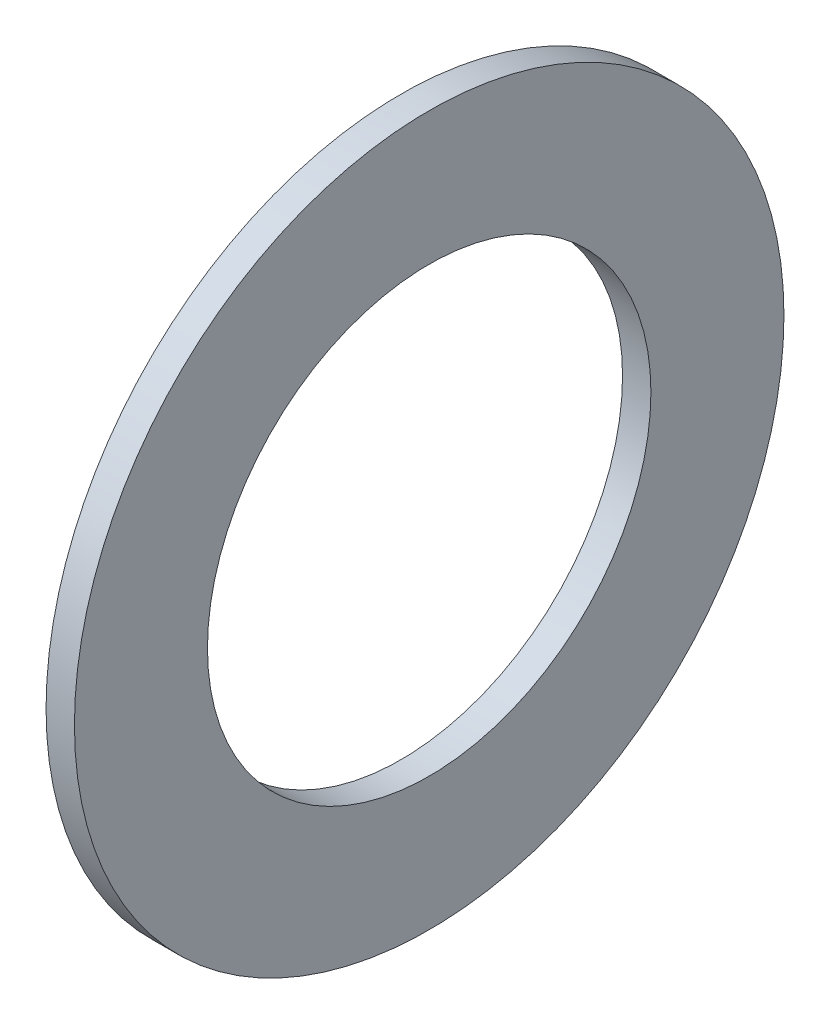
from build123d import *

# Parameters (mm, degrees)
SKETCH1_R           = 6.35
SKETCH1_R_2         = 3.96875
BOSS_EXTRUDE1_DEPTH = 0.508


with BuildPart() as part:
    # Sketch1 → Boss-Extrude1 (new body)
    with BuildSketch(Plane(origin=(0, 0, 0), x_dir=(0, 0, -1), z_dir=(1, 0, 0))):
        Circle(SKETCH1_R)
        Circle(SKETCH1_R_2, mode=Mode.SUBTRACT)
    extrude(amount=BOSS_EXTRUDE1_DEPTH)


solid = part.part
